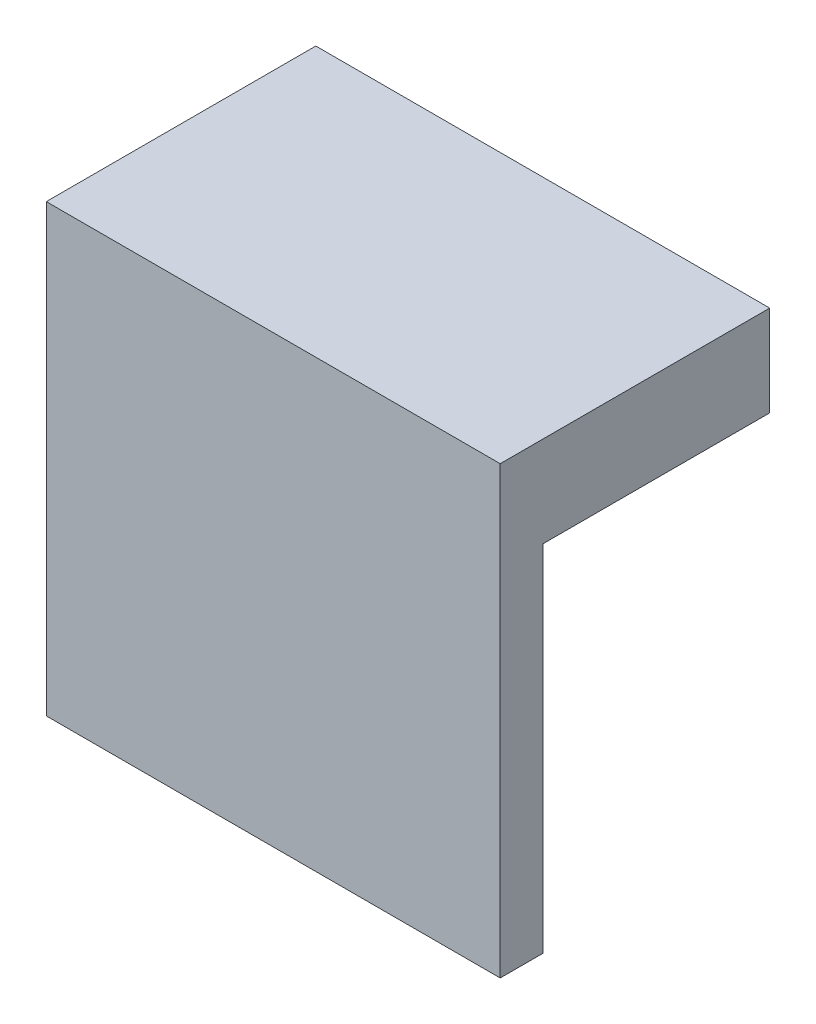
from build123d import *

# Parameters (mm, degrees)
SKETCH1_W           = 16
SKETCH1_H           = 9.5
BOSS_EXTRUDE1_DEPTH = 3.2
SKETCH2_W           = 16
SKETCH2_H           = 12.5
BOSS_EXTRUDE2_DEPTH = 1.5


with BuildPart() as part:
    # Sketch1 → Boss-Extrude1 (new body)
    with BuildSketch(Plane(origin=(0, 0, 0), x_dir=(1, 0, 0), z_dir=(0, 1, 0))):
        Rectangle(SKETCH1_W, SKETCH1_H)
    extrude(amount=BOSS_EXTRUDE1_DEPTH)

    # Sketch2 → Boss-Extrude2 (add)
    with BuildSketch(Plane.XY.offset(4.75)):
        with Locations((0, -6.25)):
            Rectangle(SKETCH2_W, SKETCH2_H)
    extrude(amount=-BOSS_EXTRUDE2_DEPTH)


solid = part.part
